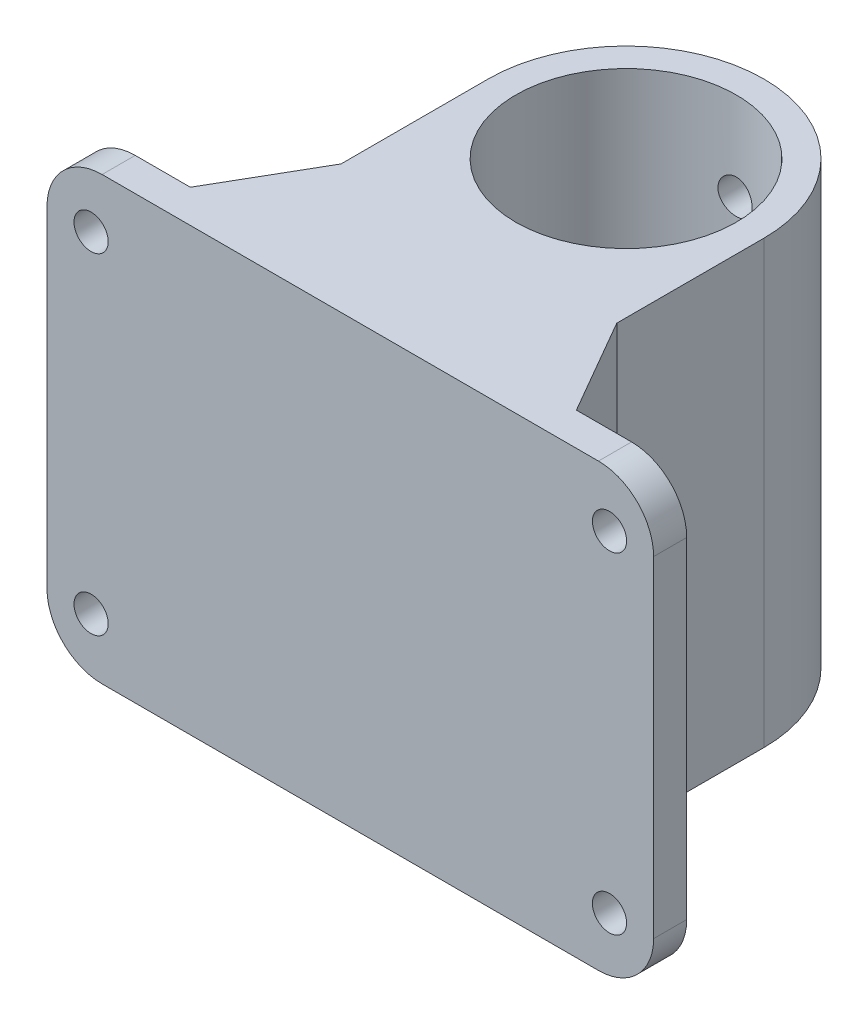
from build123d import *
from OCP.BRepFilletAPI import BRepFilletAPI_MakeChamfer

# Parameters (mm, degrees)
SKETCH_1_R          = 10
EXTRUDE_1_DEPTH     = 20
SKETCH_7_R          = 1.55
CUT_EXTRUDE_2_DEPTH = 35.369317712
SKETCH_9_W          = 3
SKETCH_9_H          = 40
EXTRUDE_2_DEPTH     = 15
SKETCH_10_R         = 1.55
CUT_EXTRUDE_3_DEPTH = 49.440685517
CHAMFER_1_SIZE      = 5
CHAMFER_1_SIZE2     = 8.660254038
FILLET_1_R          = 5


with BuildPart() as part:
    # 草图1 → 凸台-拉伸1 (new, symmetric)
    with BuildSketch(Plane(origin=(0, 0, 0), x_dir=(1, 0, 0), z_dir=(0, 1, 0))):
        with BuildLine():
            Line((-12.5, -25), (12.5, -25))
            Line((12.5, -25), (12.5, 0))
            ThreePointArc((12.5, 0), (0, 12.5), (-12.5, 0))
            Line((-12.5, 0), (-12.5, -25))
        make_face()
        with Locations(Location((0, 0, 0), (0, 0, 270))):
            Circle(SKETCH_1_R, mode=Mode.SUBTRACT)
    extrude(amount=EXTRUDE_1_DEPTH, both=True)

    # 草图7 → 切除-拉伸2 (cut, through all)
    with BuildSketch(Plane.XY):
        with Locations(Location((0, -12, 0), (0, 0, 90))):
            Circle(SKETCH_7_R)
        with Locations(Location((0, 12, 0), (0, 0, 90))):
            Circle(SKETCH_7_R)
    extrude(amount=-CUT_EXTRUDE_2_DEPTH, mode=Mode.SUBTRACT)

    # 草图9 → 凸台-拉伸2 (add)
    with BuildSketch(Plane(origin=(12.5, 0, 0), x_dir=(0, 0, -1), z_dir=(1, 0, 0))):
        with Locations((-23.5, 0)):
            Rectangle(SKETCH_9_W, SKETCH_9_H)
    extrude_2 = extrude(amount=EXTRUDE_2_DEPTH)

    # 草图10 → 切除-拉伸3 (cut, through all)
    with BuildSketch(Plane(origin=(0, 0, 22), x_dir=(-1, 0, 0), z_dir=(0, 0, -1))):
        with Locations((-23.5, 15)):
            Circle(SKETCH_10_R)
        with Locations(Location((-23.5, -15, 0), (0, 0, 180))):
            Circle(SKETCH_10_R)
    cut_extrude_3 = extrude(amount=-CUT_EXTRUDE_3_DEPTH, mode=Mode.SUBTRACT)

    # 镜向6: 凸台-拉伸2, 切除-拉伸3 across plane
    add(extrude_2.mirror(Plane(origin=(0, 0, 0), x_dir=(0, 0, 1), z_dir=(1, 0, 0))))
    add(cut_extrude_3.mirror(Plane(origin=(0, 0, 0), x_dir=(0, 0, 1), z_dir=(1, 0, 0))), mode=Mode.SUBTRACT)

    # 倒角1: one chamfer whose edges measure the first distance from different faces: ONE call of the kernel's chamfer builder (chamfer() names one face for all edges)
    chamfer_1_edges_1 = [part.edges().sort_by_distance(p)[0] for p in [
        (12.5, 0, 22),
    ]]
    chamfer_1_side_1 = [part.faces().sort_by_distance(p)[0] for p in [
        (19.909671201, 0, 22),
    ]]
    chamfer_1_edges_2 = [part.edges().sort_by_distance(p)[0] for p in [
        (-12.5, 0, 22),
    ]]
    chamfer_1_side_2 = [part.faces().sort_by_distance(p)[0] for p in [
        (-19.909671201, 0, 22),
    ]]
    chamfer_1 = BRepFilletAPI_MakeChamfer(part.part.solid().wrapped)
    for e in chamfer_1_edges_1:
        chamfer_1.Add(CHAMFER_1_SIZE, CHAMFER_1_SIZE2, e.wrapped, chamfer_1_side_1[0].wrapped)  # the first distance lies on this face
    for e in chamfer_1_edges_2:
        chamfer_1.Add(CHAMFER_1_SIZE, CHAMFER_1_SIZE2, e.wrapped, chamfer_1_side_2[0].wrapped)  # the first distance lies on this face
    add(Compound.cast(chamfer_1.Shape()), mode=Mode.REPLACE)

    # 圆角1
    fillet_1_edges = [part.edges().sort_by_distance(p)[0] for p in [
        (27.5, -20, 23.5),
        (27.5, 20, 23.5),
        (-27.5, 20, 23.5),
        (-27.5, -20, 23.5),
    ]]
    fillet(fillet_1_edges, radius=FILLET_1_R)


solid = part.part
